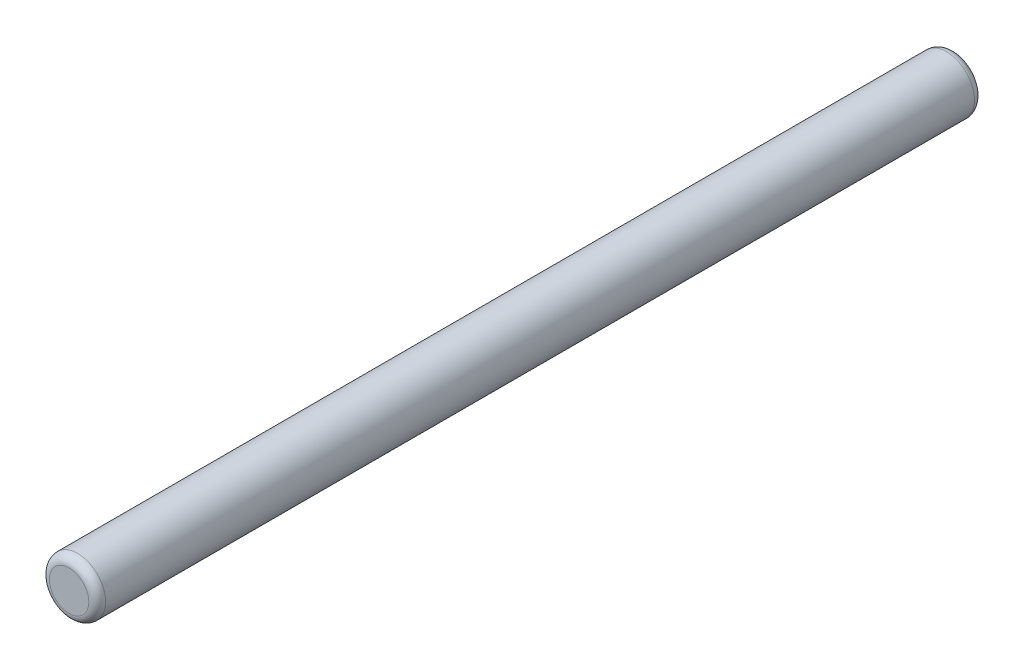
from build123d import *

# Parameters (mm, degrees)
SKETCH1_R           = 0.5
BOSS_EXTRUDE1_DEPTH = 15.75
FILLET1_R           = 0.15


with BuildPart() as part:
    # Sketch1 → Boss-Extrude1 (new body)
    with BuildSketch(Plane.XY):
        Circle(SKETCH1_R)
    extrude(amount=BOSS_EXTRUDE1_DEPTH)

    # Fillet1
    fillet1_edges = [part.edges().sort_by_distance(p)[0] for p in [
        (-0.5, 0, 0),
        (-0.5, 0, 15.75),
    ]]
    fillet(fillet1_edges, radius=FILLET1_R)


solid = part.part
